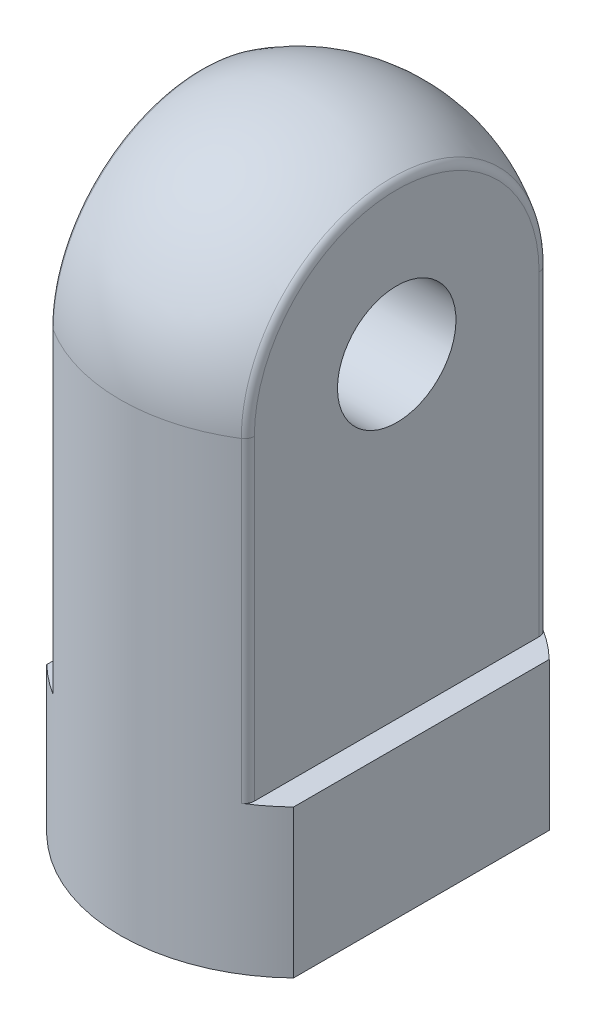
from build123d import *

# Parameters (mm, degrees)
SKETCH_1_R               = 18
EXTRUDE_1_DEPTH          = 65
FILLET_1_R               = 18
CUT_EXTRUDE_2_DEPTH      = 70.806876452
CUT_EXTRUDE_2_DEPTH_BACK = 70.806876452
SKETCH_2_OUTSIDE_W       = 54.514
SKETCH_2_OUTSIDE_H       = 83.514
SKETCH_3_R               = 6
CUT_EXTRUDE_3_DEPTH      = 80
M12X1_75_1_D             = 10.2
M12X1_75_1_DEPTH         = 32.75
M12X1_75_1_TIP           = 3.064389157
FILLET_2_R               = 1


with BuildPart() as part:
    # 草图1 → 拉伸1 (new body)
    with BuildSketch(Plane(origin=(0, 0, 0), x_dir=(1, 0, 0), z_dir=(0, 1, 0))):
        with Locations(Location((0, 0, 0), (0, 0, 270))):
            Circle(SKETCH_1_R)
    extrude(amount=EXTRUDE_1_DEPTH)

    # 圆角1
    fillet_1_edges = [part.edges().sort_by_distance(p)[0] for p in [
        (0, 65, -18),
    ]]
    fillet(fillet_1_edges, radius=FILLET_1_R)

    # 草图2 outside → 拉伸2 (cut, two sides: drawn at the far end of the back side and taken through both)
    with BuildSketch(Plane.XY.offset(-CUT_EXTRUDE_2_DEPTH_BACK)):
        with Locations((0, 32.5)):
            Rectangle(SKETCH_2_OUTSIDE_W, SKETCH_2_OUTSIDE_H)
        Polygon((-12.5, 0), (-12.5, 15), (-10, 15), (-10, 85.518474484), (10, 85.518474484), (10, 15), (12.5, 15), (12.5, 0), align=None, mode=Mode.SUBTRACT)
    extrude(amount=CUT_EXTRUDE_2_DEPTH + CUT_EXTRUDE_2_DEPTH_BACK, mode=Mode.SUBTRACT)

    # 草图3 → 拉伸3 (cut)
    with BuildSketch(Plane.ZY.offset(10)):
        with Locations((0, 47)):
            Circle(SKETCH_3_R)
    extrude(amount=-CUT_EXTRUDE_3_DEPTH, mode=Mode.SUBTRACT)

    # M12x1.75 螺纹孔1
    with Locations(Plane.XZ):
        with Locations((0, 0)):
            Hole(M12X1_75_1_D / 2, depth=M12X1_75_1_DEPTH)
            with Locations((0, 0, -(M12X1_75_1_DEPTH + M12X1_75_1_TIP / 2))):  # 118° drill point
                Cone(0, M12X1_75_1_D / 2, M12X1_75_1_TIP, mode=Mode.SUBTRACT)

    # 圆角2
    fillet_2_edges = [part.edges().sort_by_distance(p)[0] for p in [
        (-10, 31, -14.966629547),
        (-10, 31, 14.966629547),
        (10, 31, 14.966629547),
        (10, 31, -14.966629547),
        (10, 61.966629547, 0),
        (-10, 61.966629547, 0),
    ]]
    fillet(fillet_2_edges, radius=FILLET_2_R)


solid = part.part
